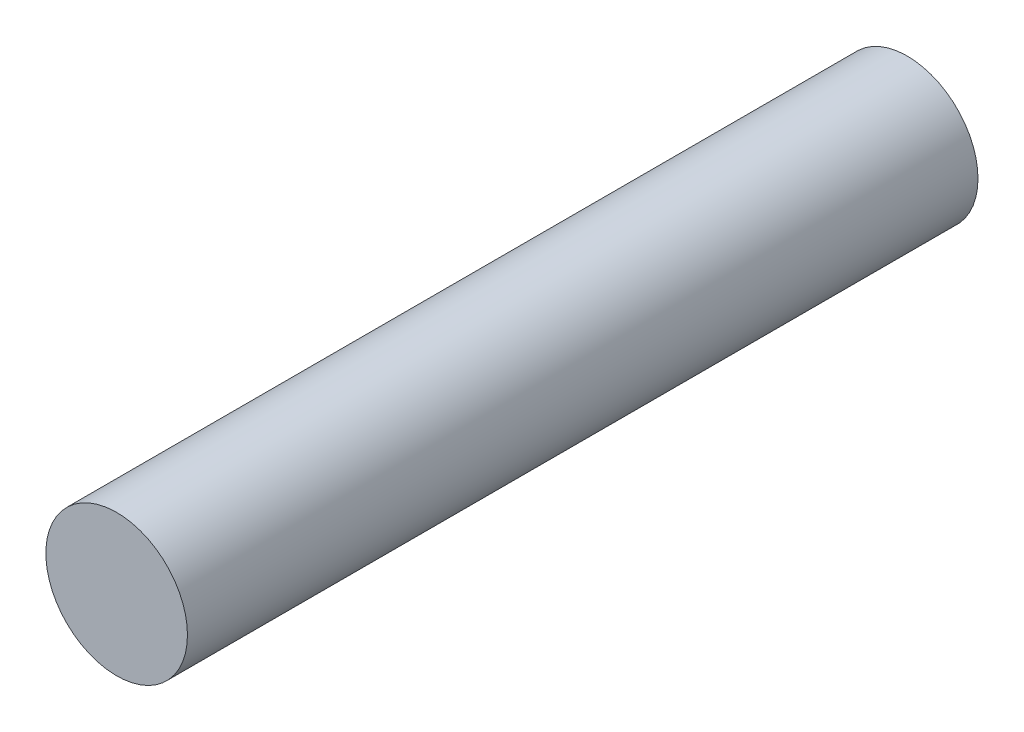
from build123d import *

# Parameters (mm, degrees)
MAIN_BODY_SKETCH_R      = 1.5
MAIN_BODY_EXTRUDE_DEPTH = 16.75


with BuildPart() as part:
    # Main Body Sketch → Main Body Extrude (new body)
    with BuildSketch(Plane.XY):
        Circle(MAIN_BODY_SKETCH_R)
    extrude(amount=-MAIN_BODY_EXTRUDE_DEPTH)


solid = part.part
